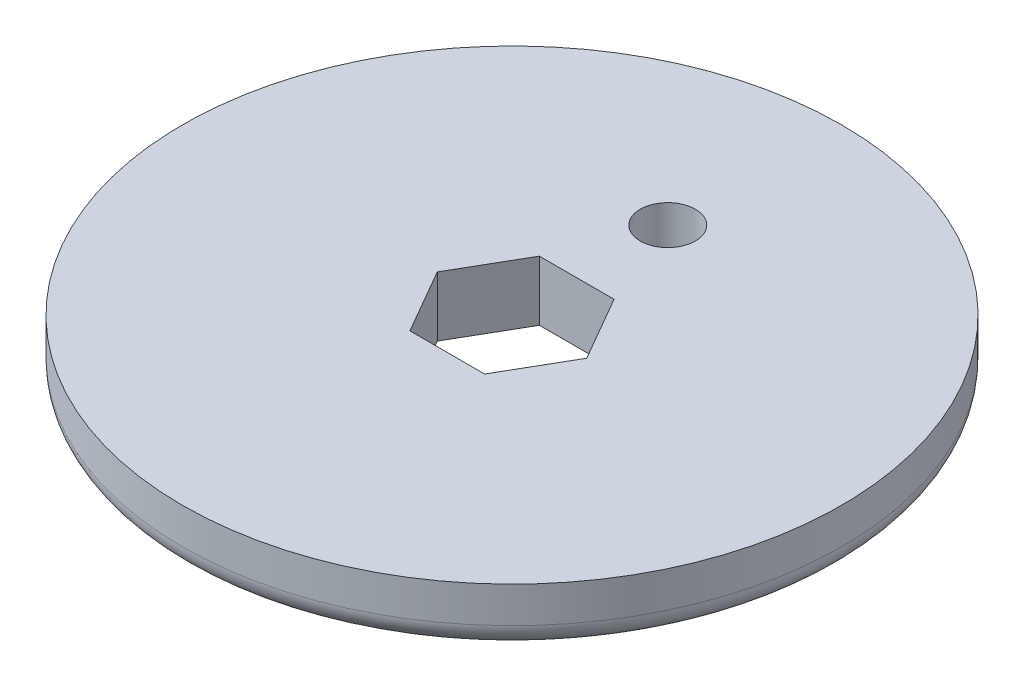
from build123d import *

# Parameters (mm, degrees)
SKETCH1_R           = 34.925
BOSS_EXTRUDE1_DEPTH = 6.35
FILLET1_R           = 2.54
SKETCH2_R           = 2.921
CUT_EXTRUDE1_DEPTH  = 50.797929174


with BuildPart() as part:
    # Sketch1 → Boss-Extrude1 (new body)
    with BuildSketch(Plane(origin=(0, 0, 0), x_dir=(1, 0, 0), z_dir=(0, 1, 0))):
        with Locations(Location((0, 0, 0), (0, 0, 270))):
            Circle(SKETCH1_R)
        Polygon((7.918936292, 0), (3.959468146, 6.858), (-3.959468146, 6.858), (-7.918936292, 0), (-3.959468146, -6.858), (3.959468146, -6.858), align=None, mode=Mode.SUBTRACT)
    extrude(amount=BOSS_EXTRUDE1_DEPTH)

    # Fillet1
    fillet1_edges = [part.edges().sort_by_distance(p)[0] for p in [
        (0, 0, -34.925),
    ]]
    fillet(fillet1_edges, radius=FILLET1_R)

    # Sketch2 → Cut-Extrude1 (cut, through all)
    with BuildSketch(Plane(origin=(0, 6.35, 0), x_dir=(1, 0, 0), z_dir=(0, 1, 0))):
        with Locations(Location((0, 16.51, 0), (0, 0, 270))):
            Circle(SKETCH2_R)
    extrude(amount=-CUT_EXTRUDE1_DEPTH, mode=Mode.SUBTRACT)


solid = part.part
